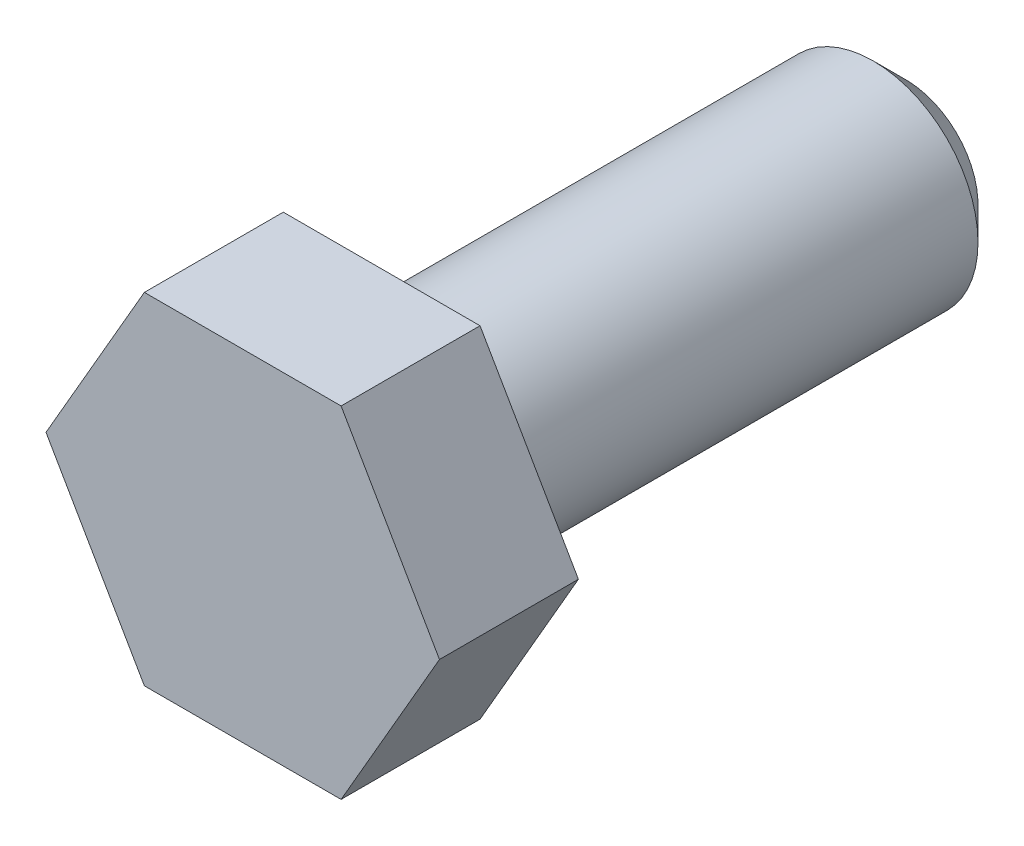
from build123d import *

# Parameters (mm, degrees)
BASE_EXTRUDE_DEPTH  = 5.3
SKETCH3_R           = 4
BOSS_EXTRUDE1_DEPTH = 20
CHAMFER1_SIZE       = 1.25


with BuildPart() as part:
    # Sketch1 → Base-Extrude (new body)
    with BuildSketch(Plane.XY):
        Polygon((-3.75277675, 6.5), (3.75277675, 6.5), (7.505553499, 0), (3.75277675, -6.5), (-3.75277675, -6.5), (-7.505553499, 0), align=None)
    extrude(amount=BASE_EXTRUDE_DEPTH)

    # Sketch3 → Boss-Extrude1 (add)
    with BuildSketch(Plane(origin=(0, 0, 0), x_dir=(-1, 0, 0), z_dir=(0, 0, -1))):
        with Locations(Location((0, 0, 0), (0, 0, 180))):
            Circle(SKETCH3_R)
    extrude(amount=BOSS_EXTRUDE1_DEPTH)

    # Chamfer1
    chamfer1_edges = [part.edges().sort_by_distance(p)[0] for p in [
        (-4, 0, -20),
    ]]
    chamfer(chamfer1_edges, length=CHAMFER1_SIZE)


solid = part.part
